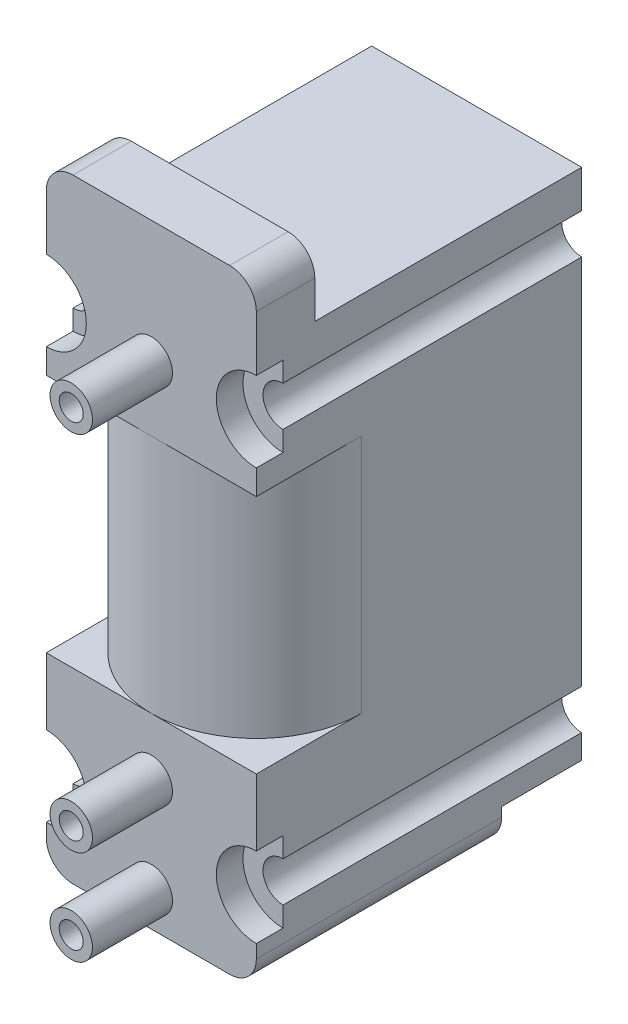
from build123d import *

# Parameters (mm, degrees)
SKETCH1_W           = 7.87
SKETCH1_H           = 23
BOSS_EXTRUDE1_DEPTH = 12.19
SKETCH2_R           = 0.79375
BOSS_EXTRUDE2_DEPTH = 3
SKETCH3_R           = 0.75
CUT_EXTRUDE1_DEPTH  = 12.19
FILLET1_R           = 1
SKETCH4_R           = 1.5
CUT_EXTRUDE2_DEPTH  = 1
SKETCH5_W           = 7.87
SKETCH5_H           = 2.41
CUT_EXTRUDE3_DEPTH  = 10
CUT_EXTRUDE4_START  = -3
CUT_EXTRUDE4_DEPTH  = 3
SKETCH7_R           = 0.45
CUT_EXTRUDE5_DEPTH  = 8
CUT_EXTRUDE6_DEPTH  = 9


with BuildPart() as part:
    # Sketch1 → Boss-Extrude1 (new body)
    with BuildSketch(Plane.XY):
        with Locations((3.935, 11.5)):
            Rectangle(SKETCH1_W, SKETCH1_H)
    extrude(amount=BOSS_EXTRUDE1_DEPTH)

    # Sketch2 → Boss-Extrude2 (add)
    with BuildSketch(Plane.XY.offset(12.19)):
        with Locations(Location((3.935, 18.43, 0), (0, 0, 180))):
            Circle(SKETCH2_R)
        with Locations(Location((3.935, 4.854367324, 0), (0, 0, 180))):
            Circle(SKETCH2_R)
        with Locations(Location((3.935, 1.31, 0), (0, 0, 180))):
            Circle(SKETCH2_R)
    extrude(amount=BOSS_EXTRUDE2_DEPTH)

    # Sketch3 → Cut-Extrude1 (cut)
    with BuildSketch(Plane.XY.offset(12.19)):
        with Locations((0, 18.43)):
            Circle(SKETCH3_R)
        with Locations((0, 3)):
            Circle(SKETCH3_R)
        with Locations((7.87, 3)):
            Circle(SKETCH3_R)
        with Locations((7.87, 18.43)):
            Circle(SKETCH3_R)
    extrude(amount=-CUT_EXTRUDE1_DEPTH, mode=Mode.SUBTRACT)

    # Fillet1
    fillet1_edges = [part.edges().sort_by_distance(p)[0] for p in [
        (0, 23, 6.095),
        (7.87, 23, 6.095),
        (7.87, 0, 6.095),
        (0, 0, 6.095),
    ]]
    fillet(fillet1_edges, radius=FILLET1_R)

    # Sketch4 → Cut-Extrude2 (cut)
    with BuildSketch(Plane.XY.offset(12.19)):
        with Locations((0, 18.43)):
            Circle(SKETCH4_R)
        with Locations((0, 3)):
            Circle(SKETCH4_R)
        with Locations((7.87, 3)):
            Circle(SKETCH4_R)
        with Locations((7.87, 18.43)):
            Circle(SKETCH4_R)
    extrude(amount=-CUT_EXTRUDE2_DEPTH, mode=Mode.SUBTRACT)

    # Sketch5 → Cut-Extrude3 (cut)
    with BuildSketch(Plane(origin=(0, 0, 0), x_dir=(-1, 0, 0), z_dir=(0, 0, -1))):
        with Locations((-3.935, 21.795)):
            Rectangle(SKETCH5_W, SKETCH5_H)
    extrude(amount=-CUT_EXTRUDE3_DEPTH, mode=Mode.SUBTRACT)

    # Sketch6 → Cut-Extrude4 (cut)
    with BuildSketch(Plane(origin=(0, 0, 0), x_dir=(-1, 0, 0), z_dir=(0, 0, -1)).offset(CUT_EXTRUDE4_START)):
        with BuildLine():
            Line((-7.87, 1.349131469), (-7.01383854, 1.349131469))
            ThreePointArc((-7.01383854, 1.349131469), (-6.660285149, 1.495578078), (-6.51383854, 1.849131469))
            Line((-6.51383854, 1.849131469), (-6.51383854, 1.968890308))
            ThreePointArc((-6.51383854, 1.968890308), (-6.36739193, 2.322443699), (-6.01383854, 2.468890308))
            Line((-6.01383854, 2.468890308), (-1.85616146, 2.468890308))
            ThreePointArc((-1.85616146, 2.468890308), (-1.50260807, 2.322443699), (-1.35616146, 1.968890308))
            Line((-1.35616146, 1.968890308), (-1.35616146, 1.849131469))
            ThreePointArc((-1.35616146, 1.849131469), (-1.209714851, 1.495578078), (-0.85616146, 1.349131469))
            Line((-0.85616146, 1.349131469), (0, 1.349131469))
            Line((0, 1.349131469), (0, 1))
            ThreePointArc((0, 1), (-0.292893219, 0.292893219), (-1, 0))
            Line((-1, 0), (-6.87, 0))
            ThreePointArc((-6.87, 0), (-7.577106781, 0.292893219), (-7.87, 1))
            Line((-7.87, 1), (-7.87, 1.349131469))
        make_face()
    extrude(amount=CUT_EXTRUDE4_DEPTH, mode=Mode.SUBTRACT)

    # Sketch7 → Cut-Extrude5 (cut)
    with BuildSketch(Plane.XY.offset(15.19)):
        with Locations((3.935, 18.43)):
            Circle(SKETCH7_R)
        with Locations((3.935, 4.854367324)):
            Circle(SKETCH7_R)
        with Locations((3.935, 1.31)):
            Circle(SKETCH7_R)
    extrude(amount=-CUT_EXTRUDE5_DEPTH, mode=Mode.SUBTRACT)

    # Sketch8 → Cut-Extrude6 (cut)
    with BuildSketch(Plane(origin=(0, 7, 0), x_dir=(-1, 0, 0), z_dir=(0, -1, 0))):
        with BuildLine():
            Line((0, -12.19), (0, -8.255))
            ThreePointArc((0, -8.255), (-1.152534816, -11.037465184), (-3.935, -12.19))
            Line((-3.935, -12.19), (0, -12.19))
        make_face()
        with BuildLine():
            Line((-7.87, -12.19), (-3.935, -12.19))
            ThreePointArc((-3.935, -12.19), (-6.717465184, -11.037465184), (-7.87, -8.255))
            Line((-7.87, -8.255), (-7.87, -12.19))
        make_face()
    extrude(amount=-CUT_EXTRUDE6_DEPTH, mode=Mode.SUBTRACT)


solid = part.part
